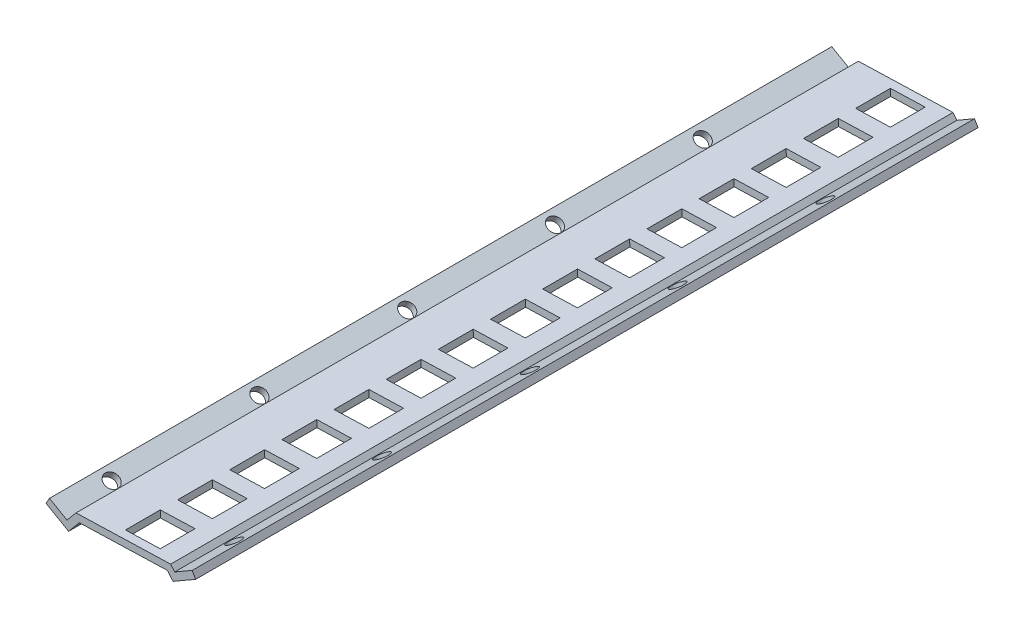
from build123d import *

# Parameters (mm, degrees)
BOSS_EXTRUDE1_DEPTH = 171
SKETCH2_R           = 1.25
CUT_EXTRUDE1_DEPTH  = 10
SKETCH4_R           = 1.25
CUT_EXTRUDE2_DEPTH  = 10
LPATTERN1_COUNT     = 7
LPATTERN1_PITCH     = 25.5
SKETCH5_W           = 6
SKETCH5_H           = 6
CUT_EXTRUDE3_DEPTH  = 10
LPATTERN2_COUNT     = 19
LPATTERN2_PITCH     = 9
SKETCH6_W           = 39.406826709
SKETCH6_H           = 10.111121127
CUT_EXTRUDE4_DEPTH  = 36


with BuildPart() as part:
    # Sketch1 → Boss-Extrude1 (new body)
    with BuildSketch(Plane.XY):
        Polygon((-7.560747901, -2.297203345), (8.76644945, -1.788652997), (9.457807768, -2.612581756), (12.482904169, -0.866041535), (13.082904169, -1.905272019), (9.185789852, -4.155272019), (8.221608437, -3.006205355), (-6.986662858, -3.479904024), (-8.845450789, -5.695121219), (-12.742565106, -3.445121219), (-12.142565106, -2.405890734), (-9.117468705, -4.152430955), align=None)
    extrude(amount=BOSS_EXTRUDE1_DEPTH)

    # Sketch2 → Cut-Extrude1 (cut)
    with BuildSketch(Plane(origin=(3.495733027, -6.054787213, 0), x_dir=(0.8660254037844403, 0.49999999999999734, 0), z_dir=(-0.49999999999999734, 0.8660254037844403, 0))):
        with Locations(Location((8.377491356, -162, 0), (0, 0, 180))):
            Circle(SKETCH2_R)
    cut_extrude1 = extrude(amount=-CUT_EXTRUDE1_DEPTH, mode=Mode.SUBTRACT)

    # Sketch4 → Cut-Extrude2 (cut)
    with BuildSketch(Plane(origin=(-4.077422524, -7.062302975, 0), x_dir=(0.8660254037844392, -0.49999999999999917, 0), z_dir=(0.49999999999999917, 0.8660254037844392, 0))):
        with Locations(Location((-7.312824482, -162, 0), (0, 0, 180))):
            Circle(SKETCH4_R)
    cut_extrude2 = extrude(amount=-CUT_EXTRUDE2_DEPTH, mode=Mode.SUBTRACT)

    # LPattern1: Cut-Extrude1, Cut-Extrude2 ×7
    with Locations(*[(0, 0, -i * LPATTERN1_PITCH) for i in range(1, LPATTERN1_COUNT)]):
        add(cut_extrude1, mode=Mode.SUBTRACT)
        add(cut_extrude2, mode=Mode.SUBTRACT)

    # Sketch5 → Cut-Extrude3 (cut)
    with BuildSketch(Plane(origin=(0.064154599, -2.059707176, 0), x_dir=(0.9995152712604761, 0.031132338766899612, 0), z_dir=(-0.031132338766899612, 0.9995152712604761, 0))):
        with Locations((2.406515149, -166.5)):
            Rectangle(SKETCH5_W, SKETCH5_H)
    cut_extrude3 = extrude(amount=-CUT_EXTRUDE3_DEPTH, mode=Mode.SUBTRACT)

    # LPattern2: Cut-Extrude3 ×19
    with Locations(*[(0, 0, -i * LPATTERN2_PITCH) for i in range(1, LPATTERN2_COUNT)]):
        add(cut_extrude3, mode=Mode.SUBTRACT)

    # Sketch6 → Cut-Extrude4 (cut)
    with BuildSketch(Plane(origin=(0, 0, 0), x_dir=(-1, 0, 0), z_dir=(0, 0, -1))):
        with Locations((-0.40262443, -3.001999491)):
            Rectangle(SKETCH6_W, SKETCH6_H)
    extrude(amount=-CUT_EXTRUDE4_DEPTH, mode=Mode.SUBTRACT)


solid = part.part
